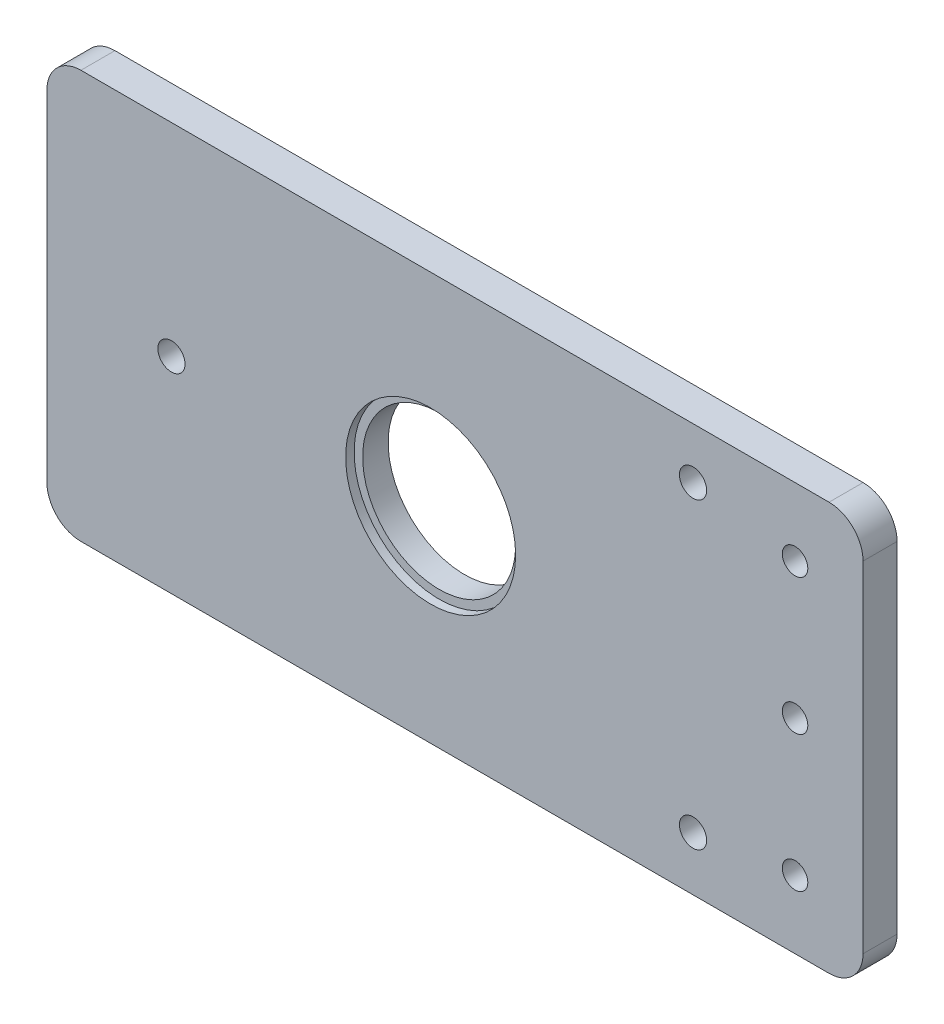
from build123d import *

# Parameters (mm, degrees)
SKETCH1_W           = 152.4
SKETCH1_H           = 76.2
SKETCH1_R           = 2.54
SKETCH1_R_2         = 2.38125
SKETCH1_R_3         = 14.2875
BOSS_EXTRUDE1_DEPTH = 6.35
FILLET1_R           = 6.35
SKETCH2_R           = 15.875
CUT_EXTRUDE1_DEPTH  = 1.5875


with BuildPart() as part:
    # Sketch1 → Boss-Extrude1 (new body)
    with BuildSketch(Plane.XY):
        Rectangle(SKETCH1_W, SKETCH1_H)
        with Locations((44.45, 28.575)):
            Circle(SKETCH1_R, mode=Mode.SUBTRACT)
        with Locations((44.45, -28.022317844)):
            Circle(SKETCH1_R, mode=Mode.SUBTRACT)
        with Locations((63.5, 25.4)):
            Circle(SKETCH1_R_2, mode=Mode.SUBTRACT)
        with Locations((63.5, 0)):
            Circle(SKETCH1_R_2, mode=Mode.SUBTRACT)
        with Locations((63.5, -25.4)):
            Circle(SKETCH1_R_2, mode=Mode.SUBTRACT)
        with Locations((-4.550000044, 0.284999938)):
            Circle(SKETCH1_R_3, mode=Mode.SUBTRACT)
        with Locations((-52.950000018, 0.284999938)):
            Circle(SKETCH1_R, mode=Mode.SUBTRACT)
    extrude(amount=BOSS_EXTRUDE1_DEPTH)

    # Fillet1
    fillet1_edges = [part.edges().sort_by_distance(p)[0] for p in [
        (76.2, -38.1, 3.175),
        (-76.2, -38.1, 3.175),
        (-76.2, 38.1, 3.175),
        (76.2, 38.1, 3.175),
    ]]
    fillet(fillet1_edges, radius=FILLET1_R)

    # Sketch2 → Cut-Extrude1 (cut)
    with BuildSketch(Plane.XY.offset(6.35)):
        with Locations((-4.550000044, 0.284999938)):
            Circle(SKETCH2_R)
    extrude(amount=-CUT_EXTRUDE1_DEPTH, mode=Mode.SUBTRACT)


solid = part.part
